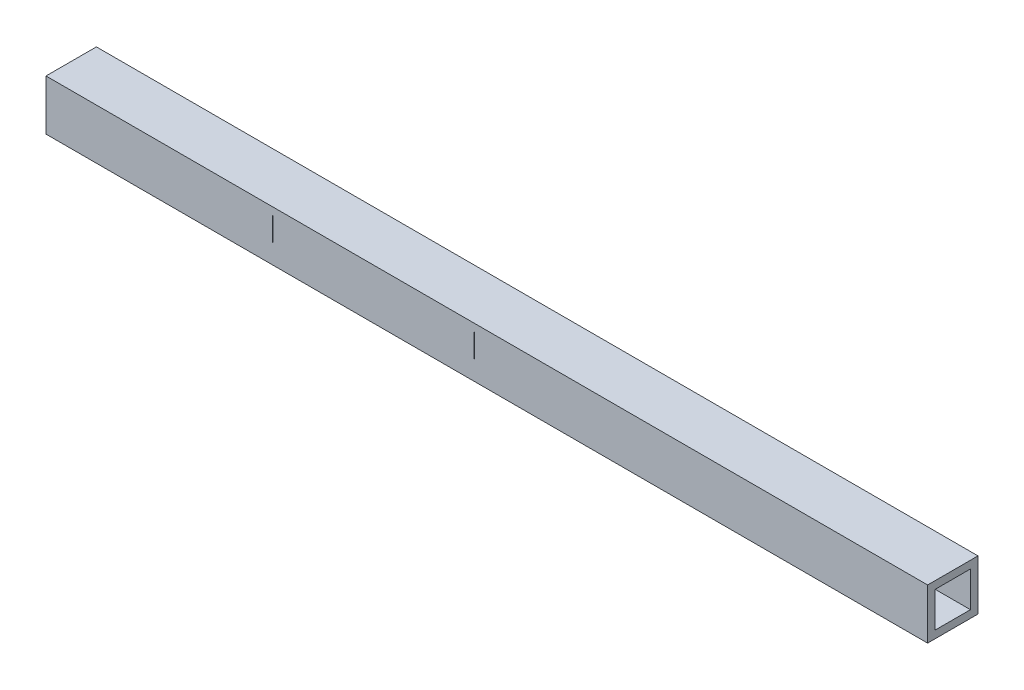
from build123d import *

# Parameters (mm, degrees)
CROQUIS1_W              = 175
CROQUIS1_H              = 10
SALIENTE_EXTRUIR1_DEPTH = 10
CROQUIS2_W              = 7
CROQUIS2_H              = 7
CORTAR_EXTRUIR1_DEPTH   = 176.142798881
CROQUIS3_W              = 0.02
CROQUIS3_H              = 4.666666667
CORTAR_EXTRUIR2_DEPTH   = 0.02
CROQUIS4_W              = 0.02
CROQUIS4_H              = 4.666666667
CORTAR_EXTRUIR3_DEPTH   = 0.02
CROQUIS5_W              = 0.02
CROQUIS5_H              = 4.666666667
CORTAR_EXTRUIR4_DEPTH   = 0.02
CROQUIS6_W              = 0.02
CROQUIS6_H              = 4.666666667
CORTAR_EXTRUIR5_DEPTH   = 0.02
CROQUIS7_W              = 0.02
CROQUIS7_H              = 4.666666667
CORTAR_EXTRUIR6_DEPTH   = 0.02
CROQUIS8_W              = 0.02
CROQUIS8_H              = 4.666666667
CORTAR_EXTRUIR7_DEPTH   = 0.02
CROQUIS9_W              = 0.02
CROQUIS9_H              = 4.666666667
CORTAR_EXTRUIR8_DEPTH   = 0.02
CROQUIS10_W             = 0.02
CROQUIS10_H             = 4.666666667
CORTAR_EXTRUIR9_DEPTH   = 0.02


with BuildPart() as part:
    # Croquis1 → Saliente-Extruir1 (new body)
    with BuildSketch(Plane.XZ.offset(5)):
        with Locations((87.5, 0)):
            Rectangle(CROQUIS1_W, CROQUIS1_H)
    extrude(amount=-SALIENTE_EXTRUIR1_DEPTH)

    # Croquis2 → Cortar-Extruir1 (cut, through all)
    with BuildSketch(Plane.ZY):
        Rectangle(CROQUIS2_W, CROQUIS2_H)
    extrude(amount=-CORTAR_EXTRUIR1_DEPTH, mode=Mode.SUBTRACT)

    # Croquis3 → Cortar-Extruir2 (cut)
    with BuildSketch(Plane.XY.offset(5)):
        with Locations((25, 1.166666666)):
            Rectangle(CROQUIS3_W, CROQUIS3_H)
    extrude(amount=-CORTAR_EXTRUIR2_DEPTH, mode=Mode.SUBTRACT)

    # Croquis4 → Cortar-Extruir3 (cut)
    with BuildSketch(Plane.XY.offset(5)):
        with Locations((35, 1.166666666)):
            Rectangle(CROQUIS4_W, CROQUIS4_H)
    extrude(amount=-CORTAR_EXTRUIR3_DEPTH, mode=Mode.SUBTRACT)

    # Croquis5 → Cortar-Extruir4 (cut)
    with BuildSketch(Plane.XY.offset(5)):
        with Locations((45, 1.166666666)):
            Rectangle(CROQUIS5_W, CROQUIS5_H)
    extrude(amount=-CORTAR_EXTRUIR4_DEPTH, mode=Mode.SUBTRACT)

    # Croquis6 → Cortar-Extruir5 (cut)
    with BuildSketch(Plane.XY.offset(5)):
        with Locations((55, 1.166666666)):
            Rectangle(CROQUIS6_W, CROQUIS6_H)
    extrude(amount=-CORTAR_EXTRUIR5_DEPTH, mode=Mode.SUBTRACT)

    # Croquis7 → Cortar-Extruir6 (cut)
    with BuildSketch(Plane.XY.offset(5)):
        with Locations((65, 1.166666666)):
            Rectangle(CROQUIS7_W, CROQUIS7_H)
    extrude(amount=-CORTAR_EXTRUIR6_DEPTH, mode=Mode.SUBTRACT)

    # Croquis8 → Cortar-Extruir7 (cut)
    with BuildSketch(Plane.XY.offset(5)):
        with Locations((75, 1.166666666)):
            Rectangle(CROQUIS8_W, CROQUIS8_H)
    extrude(amount=-CORTAR_EXTRUIR7_DEPTH, mode=Mode.SUBTRACT)

    # Croquis9 → Cortar-Extruir8 (cut)
    with BuildSketch(Plane.XY.offset(5)):
        with Locations((85, 1.166666666)):
            Rectangle(CROQUIS9_W, CROQUIS9_H)
    extrude(amount=-CORTAR_EXTRUIR8_DEPTH, mode=Mode.SUBTRACT)

    # Croquis10 → Cortar-Extruir9 (cut)
    with BuildSketch(Plane.XY.offset(5)):
        with Locations((15, 1.166666666)):
            Rectangle(CROQUIS10_W, CROQUIS10_H)
    extrude(amount=-CORTAR_EXTRUIR9_DEPTH, mode=Mode.SUBTRACT)


solid = part.part
